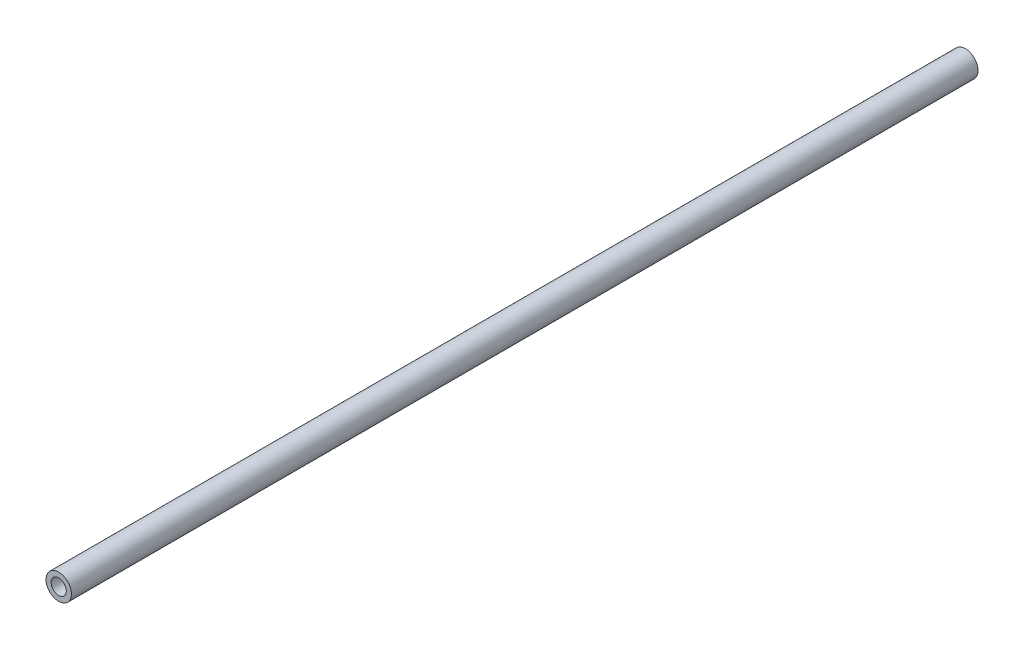
from build123d import *

# Parameters (mm, degrees)
BOSS_EXTRUDE1_DEPTH      = 304.8
BOSS_EXTRUDE1_DEPTH_BACK = 304.8
SKETCH3_R                = 8.5328125
SKETCH3_R_2              = 5.1181


with BuildPart() as part:
    # Sketch3 → Boss-Extrude1 (new, two sides: drawn at the far end of the back side and taken through both)
    with BuildSketch(Plane.XY.offset(-BOSS_EXTRUDE1_DEPTH_BACK)):
        with Locations(Location((0, 0, 0), (0, 0, 180))):
            Circle(SKETCH3_R)
        with Locations(Location((0, 0, 0), (0, 0, 180))):
            Circle(SKETCH3_R_2, mode=Mode.SUBTRACT)
    extrude(amount=BOSS_EXTRUDE1_DEPTH + BOSS_EXTRUDE1_DEPTH_BACK)


solid = part.part
